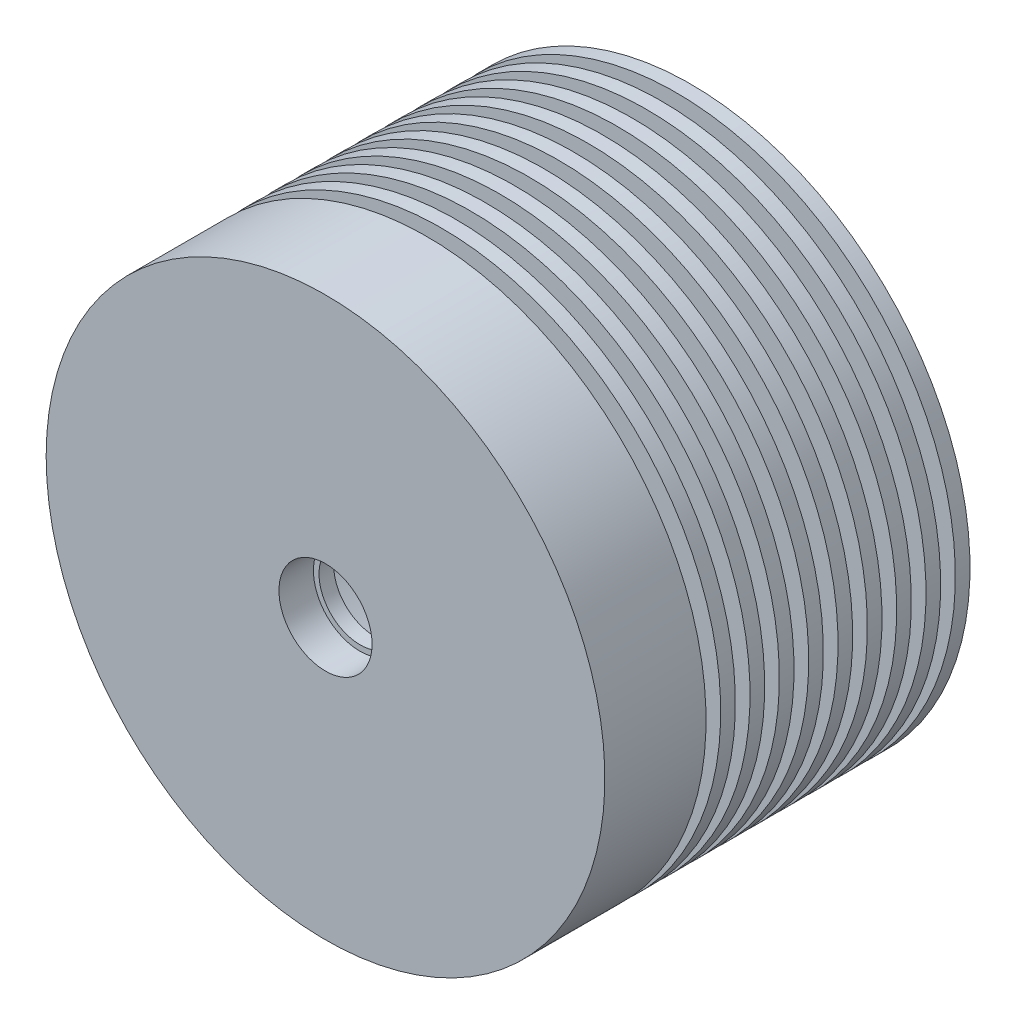
from build123d import *

# Parameters (mm, degrees)
ESQUISSE1_R                = 38.1
BOSS_EXTRU_1_DEPTH         = 51.8
ESQUISSE2_R                = 6.35
ENL_V_MAT_EXTRU_1_DEPTH    = 4.7
ESQUISSE3_R                = 5.588
ENL_V_MAT_EXTRU_2_DEPTH    = 4
ESQUISSE4_R                = 25.4
ENL_V_MAT_EXTRU_3_DEPTH    = 43.1
ESQUISSE6_OUTSIDE_W        = 102.114
ESQUISSE6_OUTSIDE_H        = 102.114
ESQUISSE6_OUTSIDE_R        = 31.75
ENL_V_MAT_EXTRU_4_DEPTH    = 2
R_P_TITION_LIN_AIRE1_COUNT = 10
R_P_TITION_LIN_AIRE1_PITCH = 4
ENL_V_START                = -2
ESQUISSE7_R                = 25.4
ENL_V_MAT_EXTRU_5_DEPTH    = 2


with BuildPart() as part:
    # Esquisse1 → Boss.-Extru.1 (new body)
    with BuildSketch(Plane.XY):
        with Locations(Location((0, 0, 0), (0, 0, 180))):
            Circle(ESQUISSE1_R)
    extrude(amount=BOSS_EXTRU_1_DEPTH)

    # Esquisse2 → Enlèv. mat.-Extru.1 (cut)
    with BuildSketch(Plane.XY.offset(51.8)):
        Circle(ESQUISSE2_R)
    extrude(amount=-ENL_V_MAT_EXTRU_1_DEPTH, mode=Mode.SUBTRACT)

    # Esquisse3 → Enlèv. mat.-Extru.2 (cut)
    with BuildSketch(Plane.XY.offset(47.1)):
        Circle(ESQUISSE3_R)
    extrude(amount=-ENL_V_MAT_EXTRU_2_DEPTH, mode=Mode.SUBTRACT)

    # Esquisse4 → Enlèv. mat.-Extru.3 (cut)
    with BuildSketch(Plane.XY.offset(43.1)):
        Circle(ESQUISSE4_R)
    extrude(amount=-ENL_V_MAT_EXTRU_3_DEPTH, mode=Mode.SUBTRACT)

    # Esquisse6 outside → Enlèv. mat.-Extru.4 (cut)
    with BuildSketch(Plane(origin=(0, 0, 0), x_dir=(-1, 0, 0), z_dir=(0, 0, -1))):
        Rectangle(ESQUISSE6_OUTSIDE_W, ESQUISSE6_OUTSIDE_H)
        Circle(ESQUISSE6_OUTSIDE_R, mode=Mode.SUBTRACT)
    enl_v_mat_extru_4 = extrude(amount=-ENL_V_MAT_EXTRU_4_DEPTH, mode=Mode.SUBTRACT)

    # Répétition linéaire1: Enlèv. mat.-Extru.4 ×10
    with Locations(*[(0, 0, i * R_P_TITION_LIN_AIRE1_PITCH) for i in range(1, R_P_TITION_LIN_AIRE1_COUNT)]):
        add(enl_v_mat_extru_4, mode=Mode.SUBTRACT)

    # Esquisse7 → Enlèv. mat.-Extru.5 (cut)
    with BuildSketch(Plane(origin=(0, 0, 43.1), x_dir=(-1, 0, 0), z_dir=(0, 0, -1)).offset(ENL_V_START)):
        with Locations(Location((0, 0, 0), (0, 0, 180))):
            Circle(ESQUISSE7_R)
    extrude(amount=ENL_V_MAT_EXTRU_5_DEPTH, mode=Mode.SUBTRACT)


solid = part.part
